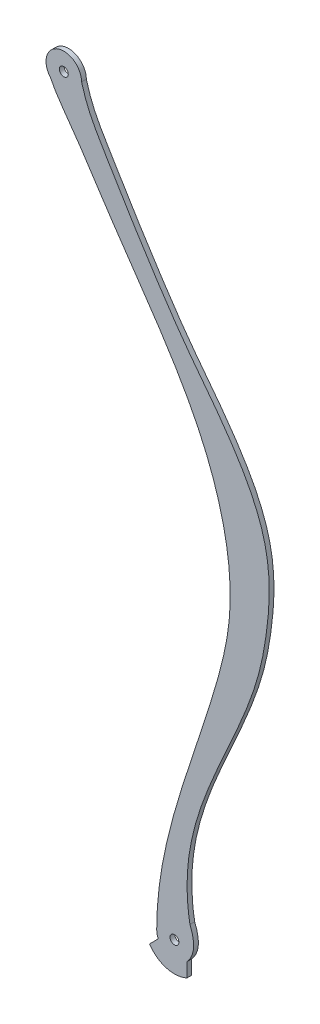
from build123d import *

# Parameters (mm, degrees)
SKETCH2_R           = 1.5
BOSS_EXTRUDE1_DEPTH = 1.6


with BuildPart() as part:
    # Sketch2 → Boss-Extrude1 (new body)
    with BuildSketch(Plane.XY):
        with BuildLine():
            Line((41.539477921, -244.07705306), (41.539477921, -239.288693537))
            add(Edge.make_bspline(
                [(42.69298474, -237.716964275), (42.217741376, -238.542489075), (41.539477921, -239.288693537)],
                knots=[0.827802852, 0.827802852, 0.827802852, 1, 1, 1], degree=2))
            add(Edge.make_bspline(
                [(42.570441122, -227.946776929), (44.977620794, -233.748421289), (42.69298474, -237.716964275)],
                knots=[0, 0, 0, 0.827802852, 0.827802852, 0.827802852], degree=2))
            add(Edge.make_bspline(
                [(6, 0), (7.763862083, -6.611935343), (16.773917449, -21.811897872), (27.463568343, -39.579399763), (42.014726868, -60.9068216), (50.400041698, -71.272280491), (68.578161477, -97.575861314), (71.353126519, -113.361048842), (61.976160464, -167.143867847), (36.574654406, -194.797637864), (42.570441122, -227.946776929)],
                knots=[0, 0, 0, 0, 0.068319261, 0.240751678, 0.269358498, 0.3449398, 0.384133739, 0.622103955, 0.65542762, 1, 1, 1, 1], degree=3))
            ThreePointArc((6, 0), (-2.135545951, 5.607088682), (-4.479814497, -3.991398511))
            add(Edge.make_bspline(
                [(-4.479814497, -3.991398511), (-2.848384876, -7.439798844), (4.366767135, -16.894248877), (22.267568782, -45.531844328), (49.554572208, -80.543332738), (58.70708865, -124.756359648), (46.782759138, -173.47813054), (31.387842566, -206.976572759), (31.343395492, -235)],
                knots=[0.015894534, 0.015894534, 0.015894534, 0.015894534, 0.059962711, 0.161342902, 0.409833567, 0.582005187, 0.668096392, 1, 1, 1, 1], degree=3))
            ThreePointArc((31.343395492, -235), (31.47814691, -236.264459994), (31.876348518, -237.472124063))
            Line((31.876348518, -237.472124063), (28.935245996, -240.413226585))
            ThreePointArc((28.935245996, -240.413226585), (34.552108449, -244.60253699), (41.539477921, -244.07705306))
        make_face()
        with Locations((37.343395492, -235)):
            Circle(SKETCH2_R, mode=Mode.SUBTRACT)
        Circle(SKETCH2_R, mode=Mode.SUBTRACT)
    extrude(amount=BOSS_EXTRUDE1_DEPTH)


solid = part.part
